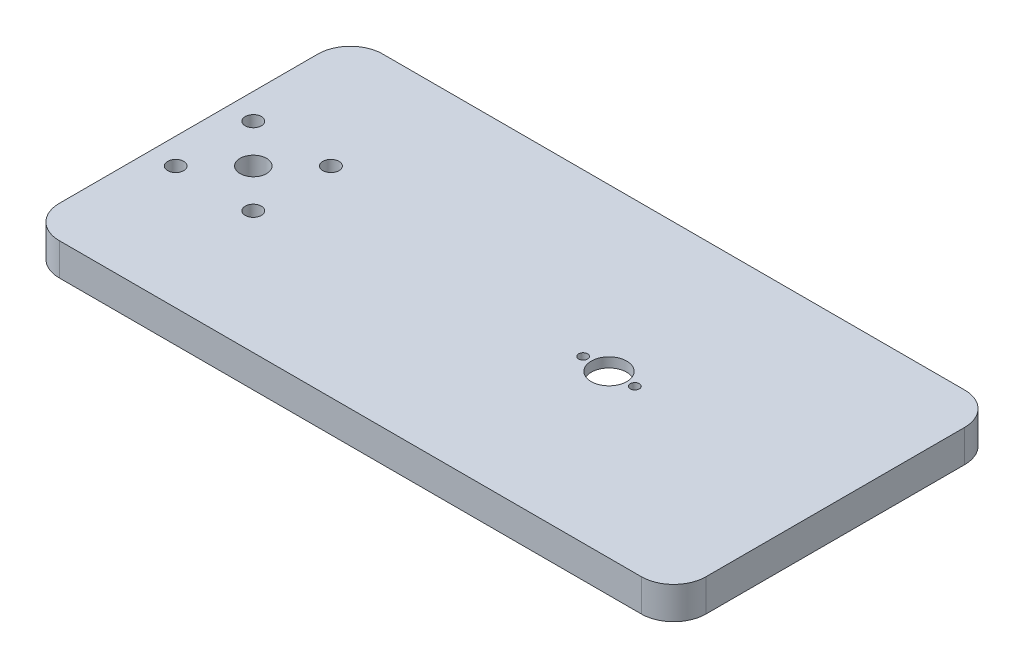
from build123d import *

# Parameters (mm, degrees)
SKETCH_1_W          = 200
SKETCH_1_H          = 100
EXTRUDE_1_DEPTH     = 10
SKETCH_2_R          = 2.5
SKETCH_2_R_2        = 5.5
SKETCH_2_R_3        = 1.4
SKETCH_2_R_4        = 4.1
CUT_EXTRUDE_1_DEPTH = 113.249721603
SKETCH_3_R          = 16
CUT_EXTRUDE_2_DEPTH = 7
FILLET_1_R          = 10
SKETCH_4_R          = 5.1
CUT_EXTRUDE_4_DEPTH = 5


with BuildPart() as part:
    # ｽｹｯﾁ1 → ﾎﾞｽ - 押し出し1 (new body)
    with BuildSketch(Plane(origin=(0, 0, 0), x_dir=(1, 0, 0), z_dir=(0, 1, 0))):
        Rectangle(SKETCH_1_W, SKETCH_1_H)
    extrude(amount=EXTRUDE_1_DEPTH)

    # ｽｹｯﾁ2 → ｶｯﾄ - 押し出し1 (cut, through all)
    with BuildSketch(Plane(origin=(0, 10, 0), x_dir=(1, 0, 0), z_dir=(0, 1, 0))):
        with Locations(Location((-92, 12, 0), (0, 0, 270))):
            Circle(SKETCH_2_R)
        with Locations(Location((-68, 12, 0), (0, 0, 270))):
            Circle(SKETCH_2_R)
        with Locations(Location((-92, -12, 0), (0, 0, 270))):
            Circle(SKETCH_2_R)
        with Locations(Location((-68, -12, 0), (0, 0, 270))):
            Circle(SKETCH_2_R)
        with Locations(Location((30, 0, 0), (0, 0, 270))):
            Circle(SKETCH_2_R_2)
        with Locations(Location((38, 0, 0), (0, 0, 270))):
            Circle(SKETCH_2_R_3)
        with Locations(Location((22, 0, 0), (0, 0, 270))):
            Circle(SKETCH_2_R_3)
        with Locations(Location((-80, 0, 0), (0, 0, 270))):
            Circle(SKETCH_2_R_4)
    extrude(amount=-CUT_EXTRUDE_1_DEPTH, mode=Mode.SUBTRACT)

    # ｽｹｯﾁ3 → ｶｯﾄ - 押し出し2 (cut)
    with BuildSketch(Plane.XZ):
        with Locations(Location((30, 0, 0), (0, 0, 270))):
            Circle(SKETCH_3_R)
    extrude(amount=-CUT_EXTRUDE_2_DEPTH, mode=Mode.SUBTRACT)

    # ﾌｨﾚｯﾄ1
    fillet_1_edges = [part.edges().sort_by_distance(p)[0] for p in [
        (100, 5, 50),
        (-100, 5, 50),
        (-100, 5, -50),
        (100, 5, -50),
    ]]
    fillet(fillet_1_edges, radius=FILLET_1_R)

    # ｽｹｯﾁ4 → ｶｯﾄ - 押し出し4 (cut)
    with BuildSketch(Plane.XZ):
        with Locations(Location((-85, 35, 0), (0, 0, 270))):
            Circle(SKETCH_4_R)
        with Locations(Location((-85, -35, 0), (0, 0, 270))):
            Circle(SKETCH_4_R)
        with Locations(Location((85, -35, 0), (0, 0, 270))):
            Circle(SKETCH_4_R)
        with Locations(Location((85, 35, 0), (0, 0, 270))):
            Circle(SKETCH_4_R)
    extrude(amount=-CUT_EXTRUDE_4_DEPTH, mode=Mode.SUBTRACT)


solid = part.part
